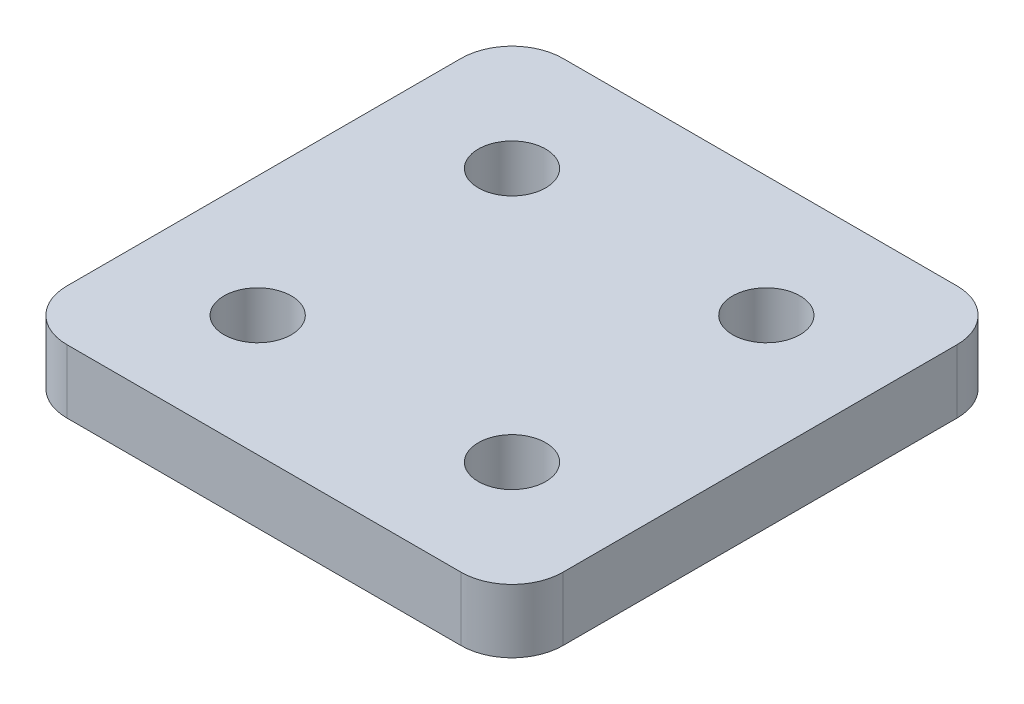
from build123d import *

# Parameters (mm, degrees)
F_4_HOLE_PROFILE_SKETCH_R        = 2.65
F_4_HOLE_THICKNESS_EXTRUDE_DEPTH = 5


with BuildPart() as part:
    # 4 Hole Profile Sketch → 4 Hole Thickness Extrude (new body)
    with BuildSketch(Plane(origin=(0, 0, 0), x_dir=(1, 0, 0), z_dir=(0, 1, 0))):
        with BuildLine():
            Line((-15.5, -19.5), (15.5, -19.5))
            ThreePointArc((15.5, -19.5), (18.328427125, -18.328427125), (19.5, -15.5))
            Line((19.5, -15.5), (19.5, 15.5))
            ThreePointArc((19.5, 15.5), (18.328427125, 18.328427125), (15.5, 19.5))
            Line((15.5, 19.5), (-15.5, 19.5))
            ThreePointArc((-15.5, 19.5), (-18.328427125, 18.328427125), (-19.5, 15.5))
            Line((-19.5, 15.5), (-19.5, -15.5))
            ThreePointArc((-19.5, -15.5), (-18.328427125, -18.328427125), (-15.5, -19.5))
        make_face()
        with Locations(Location((10, -10, 0), (0, 0, 270))):
            Circle(F_4_HOLE_PROFILE_SKETCH_R, mode=Mode.SUBTRACT)
        with Locations(Location((10, 10, 0), (0, 0, 270))):
            Circle(F_4_HOLE_PROFILE_SKETCH_R, mode=Mode.SUBTRACT)
        with Locations(Location((-10, -10, 0), (0, 0, 270))):
            Circle(F_4_HOLE_PROFILE_SKETCH_R, mode=Mode.SUBTRACT)
        with Locations(Location((-10, 10, 0), (0, 0, 270))):
            Circle(F_4_HOLE_PROFILE_SKETCH_R, mode=Mode.SUBTRACT)
    extrude(amount=F_4_HOLE_THICKNESS_EXTRUDE_DEPTH)


solid = part.part
